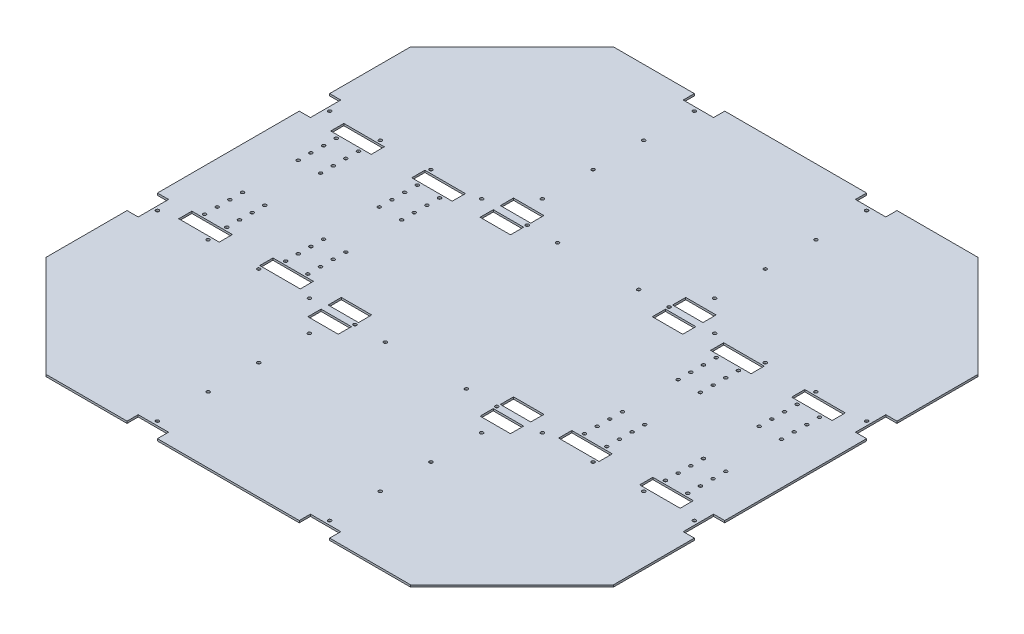
from build123d import *

# Parameters (mm, degrees)
SKETCH_1_W          = 560
SKETCH_1_H          = 560
EXTRUDE_1_DEPTH     = 2
SKETCH_3_R          = 1.6
CUT_EXTRUDE_1_DEPTH = 396.984848195
CHAMFER_1_SIZE      = 100
SKETCH_4_W          = 11
SKETCH_4_H          = 30
SKETCH_4_W_2        = 40
SKETCH_4_H_2        = 13
SKETCH_4_W_3        = 30
SKETCH_4_H_3        = 11
CUT_EXTRUDE_2_DEPTH = 396.984848195


with BuildPart() as part:
    # 草图1 → 凸台-拉伸1 (new body)
    with BuildSketch(Plane(origin=(0, 0, 0), x_dir=(1, 0, 0), z_dir=(0, 1, 0))):
        Rectangle(SKETCH_1_W, SKETCH_1_H)
    extrude(amount=EXTRUDE_1_DEPTH)

    # 草图3 → 切除-拉伸1 (cut, through all)
    with BuildSketch(Plane(origin=(0, 2, 0), x_dir=(1, 0, 0), z_dir=(0, 1, 0))):
        with Locations(Location((265, 85, 0), (0, 0, 270))):
            Circle(SKETCH_3_R)
        with Locations(Location((215, 85, 0), (0, 0, 270))):
            Circle(SKETCH_3_R)
        with Locations(Location((165, 85, 0), (0, 0, 270))):
            Circle(SKETCH_3_R)
        with Locations(Location((115, 85, 0), (0, 0, 270))):
            Circle(SKETCH_3_R)
        with Locations(Location((85, 265, 0), (0, 0, 270))):
            Circle(SKETCH_3_R)
        with Locations(Location((85, 215, 0), (0, 0, 270))):
            Circle(SKETCH_3_R)
        with Locations(Location((85, 165, 0), (0, 0, 270))):
            Circle(SKETCH_3_R)
        with Locations(Location((85, 115, 0), (0, 0, 270))):
            Circle(SKETCH_3_R)
        with Locations(Location((-85, 265, 0), (0, 0, 270))):
            Circle(SKETCH_3_R)
        with Locations(Location((-85, 215, 0), (0, 0, 270))):
            Circle(SKETCH_3_R)
        with Locations(Location((-85, 165, 0), (0, 0, 270))):
            Circle(SKETCH_3_R)
        with Locations(Location((-85, 115, 0), (0, 0, 270))):
            Circle(SKETCH_3_R)
        with Locations(Location((-115, 85, 0), (0, 0, 270))):
            Circle(SKETCH_3_R)
        with Locations(Location((-165, 85, 0), (0, 0, 270))):
            Circle(SKETCH_3_R)
        with Locations(Location((-215, 85, 0), (0, 0, 270))):
            Circle(SKETCH_3_R)
        with Locations(Location((-265, 85, 0), (0, 0, 270))):
            Circle(SKETCH_3_R)
        with Locations(Location((70, 85, 0), (0, 0, 270))):
            Circle(SKETCH_3_R)
        with Locations(Location((40, 85, 0), (0, 0, 270))):
            Circle(SKETCH_3_R)
        with Locations(Location((-40, 85, 0), (0, 0, 270))):
            Circle(SKETCH_3_R)
        with Locations(Location((-70, 85, 0), (0, 0, 270))):
            Circle(SKETCH_3_R)
        with Locations(Location((70, -85, 0), (0, 0, 270))):
            Circle(SKETCH_3_R)
        with Locations(Location((40, -85, 0), (0, 0, 270))):
            Circle(SKETCH_3_R)
        with Locations(Location((-40, -85, 0), (0, 0, 270))):
            Circle(SKETCH_3_R)
        with Locations(Location((-70, -85, 0), (0, 0, 270))):
            Circle(SKETCH_3_R)
        with Locations(Location((-115, -85, 0), (0, 0, 270))):
            Circle(SKETCH_3_R)
        with Locations(Location((-165, -85, 0), (0, 0, 270))):
            Circle(SKETCH_3_R)
        with Locations(Location((-215, -85, 0), (0, 0, 270))):
            Circle(SKETCH_3_R)
        with Locations(Location((-265, -85, 0), (0, 0, 270))):
            Circle(SKETCH_3_R)
        with Locations(Location((115, -85, 0), (0, 0, 270))):
            Circle(SKETCH_3_R)
        with Locations(Location((165, -85, 0), (0, 0, 270))):
            Circle(SKETCH_3_R)
        with Locations(Location((215, -85, 0), (0, 0, 270))):
            Circle(SKETCH_3_R)
        with Locations(Location((265, -85, 0), (0, 0, 270))):
            Circle(SKETCH_3_R)
        with Locations(Location((85, -165, 0), (0, 0, 270))):
            Circle(SKETCH_3_R)
        with Locations(Location((85, -215, 0), (0, 0, 270))):
            Circle(SKETCH_3_R)
        with Locations(Location((85, -265, 0), (0, 0, 270))):
            Circle(SKETCH_3_R)
        with Locations(Location((85, -115, 0), (0, 0, 270))):
            Circle(SKETCH_3_R)
        with Locations(Location((-85, -115, 0), (0, 0, 270))):
            Circle(SKETCH_3_R)
        with Locations(Location((-85, -165, 0), (0, 0, 270))):
            Circle(SKETCH_3_R)
        with Locations(Location((-85, -215, 0), (0, 0, 270))):
            Circle(SKETCH_3_R)
        with Locations(Location((-85, -265, 0), (0, 0, 270))):
            Circle(SKETCH_3_R)
        with Locations(Location((136.5, 65, 0), (0, 0, 270))):
            Circle(SKETCH_3_R)
        with Locations(Location((136.5, 52.5, 0), (0, 0, 270))):
            Circle(SKETCH_3_R)
        with Locations(Location((136.5, 40, 0), (0, 0, 270))):
            Circle(SKETCH_3_R)
        with Locations(Location((136.5, 27.5, 0), (0, 0, 270))):
            Circle(SKETCH_3_R)
        with Locations(Location((136.5, -40, 0), (0, 0, 270))):
            Circle(SKETCH_3_R)
        with Locations(Location((136.5, -27.5, 0), (0, 0, 270))):
            Circle(SKETCH_3_R)
        with Locations(Location((136.5, -52.5, 0), (0, 0, 270))):
            Circle(SKETCH_3_R)
        with Locations(Location((136.5, -65, 0), (0, 0, 270))):
            Circle(SKETCH_3_R)
        with Locations(Location((158.5, -65, 0), (0, 0, 270))):
            Circle(SKETCH_3_R)
        with Locations(Location((158.5, -52.5, 0), (0, 0, 270))):
            Circle(SKETCH_3_R)
        with Locations(Location((158.5, -40, 0), (0, 0, 270))):
            Circle(SKETCH_3_R)
        with Locations(Location((158.5, -27.5, 0), (0, 0, 270))):
            Circle(SKETCH_3_R)
        with Locations(Location((158.5, 27.5, 0), (0, 0, 270))):
            Circle(SKETCH_3_R)
        with Locations(Location((158.5, 40, 0), (0, 0, 270))):
            Circle(SKETCH_3_R)
        with Locations(Location((158.5, 52.5, 0), (0, 0, 270))):
            Circle(SKETCH_3_R)
        with Locations(Location((158.5, 65, 0), (0, 0, 270))):
            Circle(SKETCH_3_R)
        with Locations(Location((216.5, 65, 0), (0, 0, 270))):
            Circle(SKETCH_3_R)
        with Locations(Location((216.5, 52.5, 0), (0, 0, 270))):
            Circle(SKETCH_3_R)
        with Locations(Location((216.5, 40, 0), (0, 0, 270))):
            Circle(SKETCH_3_R)
        with Locations(Location((216.5, 27.5, 0), (0, 0, 270))):
            Circle(SKETCH_3_R)
        with Locations(Location((216.5, -27.5, 0), (0, 0, 270))):
            Circle(SKETCH_3_R)
        with Locations(Location((216.5, -40, 0), (0, 0, 270))):
            Circle(SKETCH_3_R)
        with Locations(Location((216.5, -52.5, 0), (0, 0, 270))):
            Circle(SKETCH_3_R)
        with Locations(Location((216.5, -65, 0), (0, 0, 270))):
            Circle(SKETCH_3_R)
        with Locations(Location((238.5, -65, 0), (0, 0, 270))):
            Circle(SKETCH_3_R)
        with Locations(Location((238.5, -52.5, 0), (0, 0, 270))):
            Circle(SKETCH_3_R)
        with Locations(Location((238.5, -40, 0), (0, 0, 270))):
            Circle(SKETCH_3_R)
        with Locations(Location((238.5, -27.5, 0), (0, 0, 270))):
            Circle(SKETCH_3_R)
        with Locations(Location((238.5, 65, 0), (0, 0, 270))):
            Circle(SKETCH_3_R)
        with Locations(Location((238.5, 52.5, 0), (0, 0, 270))):
            Circle(SKETCH_3_R)
        with Locations(Location((238.5, 40, 0), (0, 0, 270))):
            Circle(SKETCH_3_R)
        with Locations(Location((238.5, 27.5, 0), (0, 0, 270))):
            Circle(SKETCH_3_R)
        with Locations(Location((-238.5, 27.5, 0), (0, 0, 90))):
            Circle(SKETCH_3_R)
        with Locations(Location((-238.5, 40, 0), (0, 0, 90))):
            Circle(SKETCH_3_R)
        with Locations(Location((-238.5, 52.5, 0), (0, 0, 90))):
            Circle(SKETCH_3_R)
        with Locations(Location((-238.5, 65, 0), (0, 0, 90))):
            Circle(SKETCH_3_R)
        with Locations(Location((-238.5, -27.5, 0), (0, 0, 90))):
            Circle(SKETCH_3_R)
        with Locations(Location((-238.5, -40, 0), (0, 0, 90))):
            Circle(SKETCH_3_R)
        with Locations(Location((-238.5, -52.5, 0), (0, 0, 90))):
            Circle(SKETCH_3_R)
        with Locations(Location((-238.5, -65, 0), (0, 0, 90))):
            Circle(SKETCH_3_R)
        with Locations(Location((-216.5, -65, 0), (0, 0, 90))):
            Circle(SKETCH_3_R)
        with Locations(Location((-216.5, -52.5, 0), (0, 0, 90))):
            Circle(SKETCH_3_R)
        with Locations(Location((-216.5, -40, 0), (0, 0, 90))):
            Circle(SKETCH_3_R)
        with Locations(Location((-216.5, -27.5, 0), (0, 0, 90))):
            Circle(SKETCH_3_R)
        with Locations(Location((-216.5, 27.5, 0), (0, 0, 90))):
            Circle(SKETCH_3_R)
        with Locations(Location((-216.5, 40, 0), (0, 0, 90))):
            Circle(SKETCH_3_R)
        with Locations(Location((-216.5, 52.5, 0), (0, 0, 90))):
            Circle(SKETCH_3_R)
        with Locations(Location((-216.5, 65, 0), (0, 0, 90))):
            Circle(SKETCH_3_R)
        with Locations(Location((-158.5, 65, 0), (0, 0, 90))):
            Circle(SKETCH_3_R)
        with Locations(Location((-158.5, 52.5, 0), (0, 0, 90))):
            Circle(SKETCH_3_R)
        with Locations(Location((-158.5, 40, 0), (0, 0, 90))):
            Circle(SKETCH_3_R)
        with Locations(Location((-158.5, 27.5, 0), (0, 0, 90))):
            Circle(SKETCH_3_R)
        with Locations(Location((-158.5, -27.5, 0), (0, 0, 90))):
            Circle(SKETCH_3_R)
        with Locations(Location((-158.5, -40, 0), (0, 0, 90))):
            Circle(SKETCH_3_R)
        with Locations(Location((-158.5, -52.5, 0), (0, 0, 90))):
            Circle(SKETCH_3_R)
        with Locations(Location((-158.5, -65, 0), (0, 0, 90))):
            Circle(SKETCH_3_R)
        with Locations(Location((-136.5, -65, 0), (0, 0, 90))):
            Circle(SKETCH_3_R)
        with Locations(Location((-136.5, -52.5, 0), (0, 0, 90))):
            Circle(SKETCH_3_R)
        with Locations(Location((-136.5, -27.5, 0), (0, 0, 90))):
            Circle(SKETCH_3_R)
        with Locations(Location((-136.5, -40, 0), (0, 0, 90))):
            Circle(SKETCH_3_R)
        with Locations(Location((-136.5, 27.5, 0), (0, 0, 90))):
            Circle(SKETCH_3_R)
        with Locations(Location((-136.5, 40, 0), (0, 0, 90))):
            Circle(SKETCH_3_R)
        with Locations(Location((-136.5, 52.5, 0), (0, 0, 90))):
            Circle(SKETCH_3_R)
        with Locations(Location((-136.5, 65, 0), (0, 0, 90))):
            Circle(SKETCH_3_R)
    extrude(amount=-CUT_EXTRUDE_1_DEPTH, mode=Mode.SUBTRACT)

    # 倒角1
    chamfer_1_edges = [part.edges().sort_by_distance(p)[0] for p in [
        (280, 1, 280),
        (-280, 1, 280),
        (-280, 1, -280),
        (280, 1, -280),
    ]]
    chamfer(chamfer_1_edges, length=CHAMFER_1_SIZE)

    # 草图4 → 切除-拉伸2 (cut, through all)
    with BuildSketch(Plane(origin=(0, 2, 0), x_dir=(1, 0, 0), z_dir=(0, 1, 0))):
        with Locations((-274.5, 85)):
            Rectangle(SKETCH_4_W, SKETCH_4_H)
        with Locations((-274.5, -85)):
            Rectangle(SKETCH_4_W, SKETCH_4_H)
        with Locations((-227.5, -75)):
            Rectangle(SKETCH_4_W_2, SKETCH_4_H_2)
        with Locations((-147.5, -75)):
            Rectangle(SKETCH_4_W_2, SKETCH_4_H_2)
        with Locations((-85, -75)):
            Rectangle(SKETCH_4_W_3, SKETCH_4_H_2)
        with Locations((-85, -95)):
            Rectangle(SKETCH_4_W_3, SKETCH_4_H_2)
        with Locations((-227.5, 75)):
            Rectangle(SKETCH_4_W_2, SKETCH_4_H_2)
        with Locations((-147.5, 75)):
            Rectangle(SKETCH_4_W_2, SKETCH_4_H_2)
        with Locations((-85, 75)):
            Rectangle(SKETCH_4_W_3, SKETCH_4_H_2)
        with Locations((85, 75)):
            Rectangle(SKETCH_4_W_3, SKETCH_4_H_2)
        with Locations((147.5, 75)):
            Rectangle(SKETCH_4_W_2, SKETCH_4_H_2)
        with Locations((227.5, 75)):
            Rectangle(SKETCH_4_W_2, SKETCH_4_H_2)
        with Locations((274.5, 85)):
            Rectangle(SKETCH_4_W, SKETCH_4_H)
        with Locations((274.5, -85)):
            Rectangle(SKETCH_4_W, SKETCH_4_H)
        with Locations((227.5, -75)):
            Rectangle(SKETCH_4_W_2, SKETCH_4_H_2)
        with Locations((147.5, -75)):
            Rectangle(SKETCH_4_W_2, SKETCH_4_H_2)
        with Locations((85, -75)):
            Rectangle(SKETCH_4_W_3, SKETCH_4_H_2)
        with Locations((85, -95)):
            Rectangle(SKETCH_4_W_3, SKETCH_4_H_2)
        with Locations((-85, -274.5)):
            Rectangle(SKETCH_4_W_3, SKETCH_4_H_3)
        with Locations((85, -274.5)):
            Rectangle(SKETCH_4_W_3, SKETCH_4_H_3)
        with Locations((-85, 95)):
            Rectangle(SKETCH_4_W_3, SKETCH_4_H_2)
        with Locations((-85, 274.5)):
            Rectangle(SKETCH_4_W_3, SKETCH_4_H_3)
        with Locations((85, 274.5)):
            Rectangle(SKETCH_4_W_3, SKETCH_4_H_3)
        with Locations((85, 95)):
            Rectangle(SKETCH_4_W_3, SKETCH_4_H_2)
    extrude(amount=-CUT_EXTRUDE_2_DEPTH, mode=Mode.SUBTRACT)


solid = part.part
